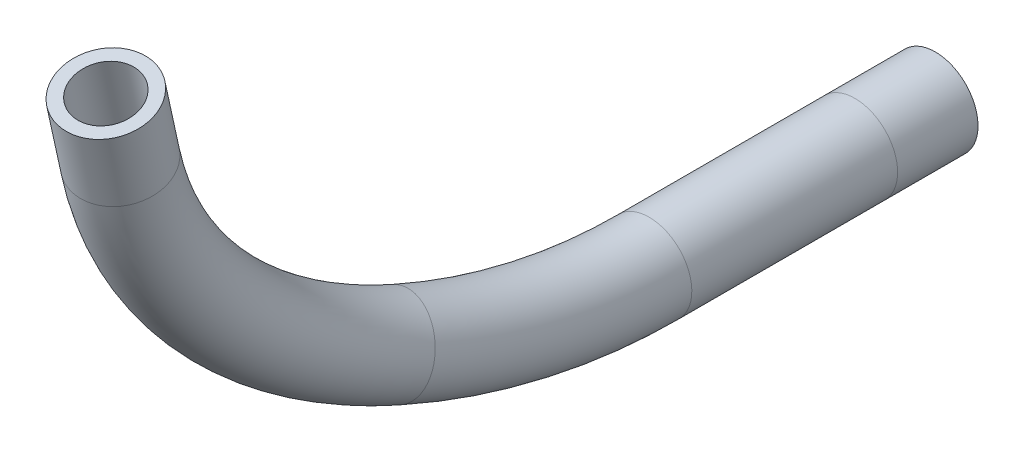
from build123d import *

# Parameters (mm, degrees)
SWEEP1_PROFILE_R     = 13.49375
CUT_SWEEP1_PROFILE_R = 9.525


with BuildPart() as part:
    # Sweep1: sweep along a curve in space
    with BuildLine() as sweep1_path:
        Line((0, 0, 0), (0, 0, -25.4))
        Line((0, 0, 0), (0, 0, 65.008326235))
        ThreePointArc((-5.864570369, 12.64082052, 138.960948382), (-1.478930869, 3.187769693, 102.635357248), (0, 0, 65.008326235))
        ThreePointArc((-11.705580718, 100.75868887, 220.409758136), (-12.308159492, 46.60541038, 190.353572184), (-5.864570369, 12.64082052, 138.960948382))
        Line((-10.149398836, 122.948822825, 226.479981937), (-11.705580718, 100.75868887, 220.409758136))
    # Sweep1 profile (on start of the path) → Sweep1 (sweep)
    with BuildSketch(Plane(origin=(-10.149398836, 122.948822825, 226.479981937), x_dir=(0, 0.26386051670744176, -0.9645608470816561), z_dir=(-0.06748988993383706, -0.9623616079186076, -0.2632589036690513))):
        Circle(SWEEP1_PROFILE_R)
    sweep(path=sweep1_path.line)

    # Cut-Sweep1: sweep along a curve in space
    with BuildLine() as cut_sweep1_path:
        Line((0, 0, 0), (0, 0, -25.4))
        Line((0, 0, 0), (0, 0, 65.008326235))
        ThreePointArc((-5.864570369, 12.64082052, 138.960948382), (-1.478930869, 3.187769693, 102.635357248), (0, 0, 65.008326235))
        ThreePointArc((-11.705580718, 100.75868887, 220.409758136), (-12.308159492, 46.60541038, 190.353572184), (-5.864570369, 12.64082052, 138.960948382))
        Line((-10.149398836, 122.948822825, 226.479981937), (-11.705580718, 100.75868887, 220.409758136))
    # Cut-Sweep1 profile (on start of the path) → Cut-Sweep1 (sweep, cut)
    with BuildSketch(Plane(origin=(-10.149398836, 122.948822825, 226.479981937), x_dir=(0, 0.26386051670744176, -0.9645608470816561), z_dir=(-0.06748988993383706, -0.9623616079186076, -0.2632589036690513))):
        Circle(CUT_SWEEP1_PROFILE_R)
    sweep(path=cut_sweep1_path.line, mode=Mode.SUBTRACT)


solid = part.part
